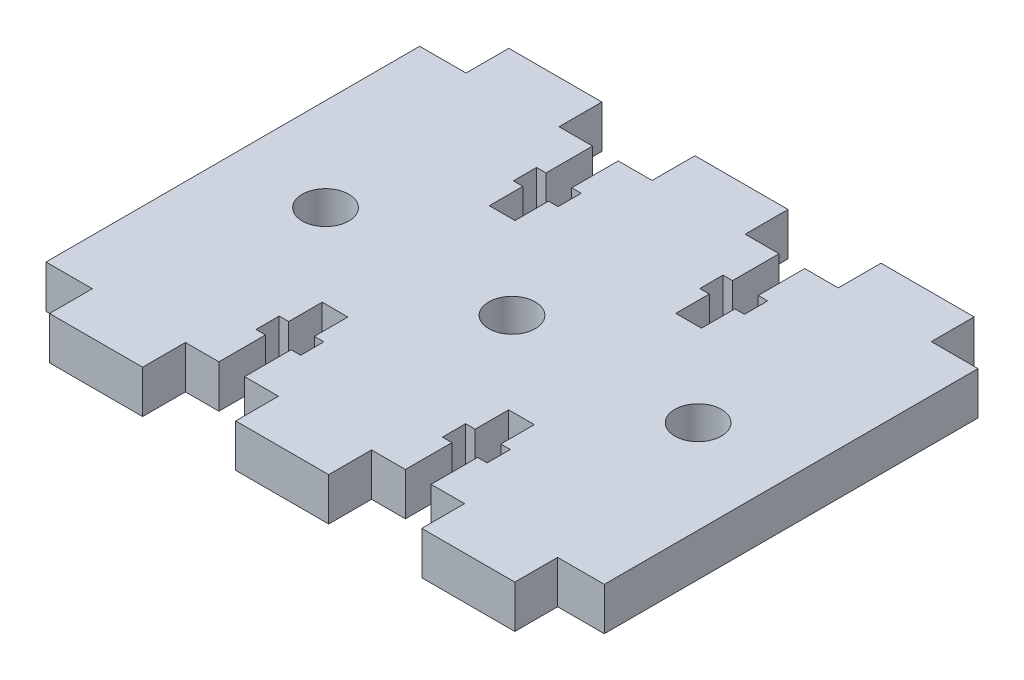
from build123d import *

# Parameters (mm, degrees)
BOSS_EXTRUDE1_DEPTH = 5.842
SKETCH2_R           = 3.175
CUT_EXTRUDE1_DEPTH  = 50.679572542


with BuildPart() as part:
    # Sketch1 → Boss-Extrude1 (new body)
    with BuildSketch(Plane(origin=(0, 0, 0), x_dir=(1, 0, 0), z_dir=(0, 1, 0))):
        Polygon((38.1, -25.5), (31.725545431, -25.5), (31.725545431, -31.342), (19.025545431, -31.342), (19.025545431, -25.5), (14.4526, -25.5), (14.4526, -19.15), (15.748, -19.15), (15.748, -15.975), (14.4526, -15.975), (14.4526, -11.403), (10.9474, -11.403), (10.9474, -15.975), (9.652, -15.975), (9.652, -19.15), (10.9474, -19.15), (10.9474, -25.5), (6.325545431, -25.5), (6.325545431, -31.342), (-6.374454569, -31.342), (-6.374454569, -25.5), (-10.996309138, -25.5), (-10.996309138, -19.15), (-9.700909138, -19.15), (-9.700909138, -15.975), (-10.996309138, -15.975), (-10.996309138, -11.403), (-14.501509138, -11.403), (-14.501509138, -15.975), (-15.796909138, -15.975), (-15.796909138, -19.15), (-14.501509138, -19.15), (-14.501509138, -25.5), (-19.074454569, -25.5), (-19.074454569, -31.342), (-31.774454569, -31.342), (-31.774454569, -25.5), (-38.1, -25.5), (-38.1, 25.5), (-31.774454569, 25.5), (-31.774454569, 31.342), (-19.074454569, 31.342), (-19.074454569, 25.5), (-14.501509138, 25.5), (-14.501509138, 19.15), (-15.796909138, 19.15), (-15.796909138, 15.975), (-14.501509138, 15.975), (-14.501509138, 11.403), (-10.996309138, 11.403), (-10.996309138, 15.975), (-9.700909138, 15.975), (-9.700909138, 19.15), (-10.996309138, 19.15), (-10.996309138, 25.5), (-6.374454569, 25.5), (-6.374454569, 31.342), (6.325545431, 31.342), (6.325545431, 25.5), (10.9474, 25.5), (10.9474, 19.15), (9.652, 19.15), (9.652, 15.975), (10.9474, 15.975), (10.9474, 11.403), (14.4526, 11.403), (14.4526, 15.975), (15.748, 15.975), (15.748, 19.15), (14.4526, 19.15), (14.4526, 25.5), (19.025545431, 25.5), (19.025545431, 31.342), (31.725545431, 31.342), (31.725545431, 25.5), (38.1, 25.5), align=None)
    extrude(amount=BOSS_EXTRUDE1_DEPTH)

    # Sketch2 → Cut-Extrude1 (cut, through all)
    with BuildSketch(Plane(origin=(0, 5.842, 0), x_dir=(1, 0, 0), z_dir=(0, 1, 0))):
        with Locations(Location((0, 0, 0), (0, 0, 270))):
            Circle(SKETCH2_R)
        with Locations(Location((25.4, 0, 0), (0, 0, 270))):
            Circle(SKETCH2_R)
        with Locations(Location((-25.448909138, 0, 0), (0, 0, 90))):
            Circle(SKETCH2_R)
    extrude(amount=-CUT_EXTRUDE1_DEPTH, mode=Mode.SUBTRACT)


solid = part.part
